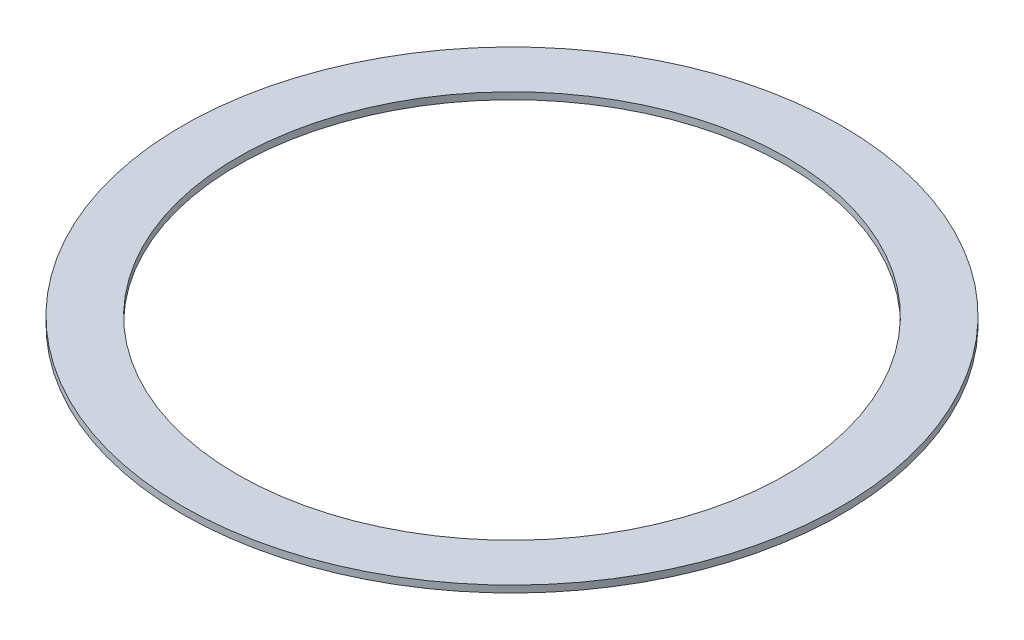
from build123d import *

# Parameters (mm, degrees)
SKETCH1_R           = 96
SKETCH1_R_2         = 80
BOSS_EXTRUDE1_DEPTH = 2


with BuildPart() as part:
    # Sketch1 → Boss-Extrude1 (new body)
    with BuildSketch(Plane(origin=(0, 0, 0), x_dir=(1, 0, 0), z_dir=(0, 1, 0))):
        with Locations(Location((0, 0, 0), (0, 0, 270))):
            Circle(SKETCH1_R)
        with Locations(Location((0, 0, 0), (0, 0, 270))):
            Circle(SKETCH1_R_2, mode=Mode.SUBTRACT)
    extrude(amount=BOSS_EXTRUDE1_DEPTH)


solid = part.part
